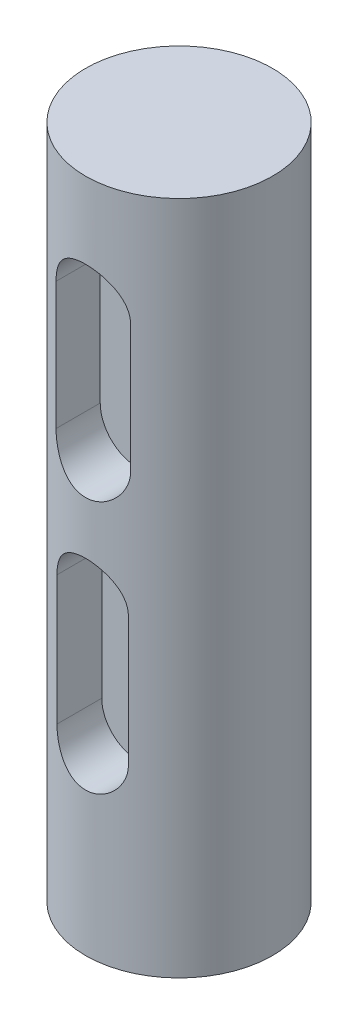
from build123d import *

# Parameters (mm, degrees)
SKETCH_2_R          = 9
EXTRUDE_1_DEPTH     = 65
CUT_EXTRUDE_START   = 9
CUT_EXTRUDE_1_DEPTH = 5
CUT_EXTRUDE_2_DEPTH = 5


with BuildPart() as part:
    # 草图2 → 凸台-拉伸1 (new body)
    with BuildSketch(Plane(origin=(0, 10, 0), x_dir=(1, 0, 0), z_dir=(0, 1, 0))):
        with Locations(Location((0, 0, 0), (0, 0, 270))):
            Circle(SKETCH_2_R)
    extrude(amount=EXTRUDE_1_DEPTH)

    # 草图4 → 切除-拉伸1 (cut)
    with BuildSketch(Plane.XY.offset(CUT_EXTRUDE_START)):
        with BuildLine():
            Line((-3.441616095, 27.248377589), (-3.441616095, 39.696776231))
            ThreePointArc((-3.441616095, 39.696776231), (0, 43.138392326), (3.441616095, 39.696776231))
            Line((3.441616095, 39.696776231), (3.441616095, 27.248377589))
            ThreePointArc((3.441616095, 27.248377589), (0, 23.806761494), (-3.441616095, 27.248377589))
        make_face()
    extrude(amount=-CUT_EXTRUDE_1_DEPTH, mode=Mode.SUBTRACT)

    # 草图5 → 切除-拉伸2 (cut)
    with BuildSketch(Plane.XY.offset(9)):
        with BuildLine():
            Line((-3.590752792, 51.789816315), (-3.590752792, 64.069272059))
            ThreePointArc((-3.590752792, 64.069272059), (0, 67.660024851), (3.590752792, 64.069272059))
            Line((3.590752792, 64.069272059), (3.590752792, 51.789816315))
            ThreePointArc((3.590752792, 51.789816315), (0, 48.199063523), (-3.590752792, 51.789816315))
        make_face()
    extrude(amount=-CUT_EXTRUDE_2_DEPTH, mode=Mode.SUBTRACT)


solid = part.part
